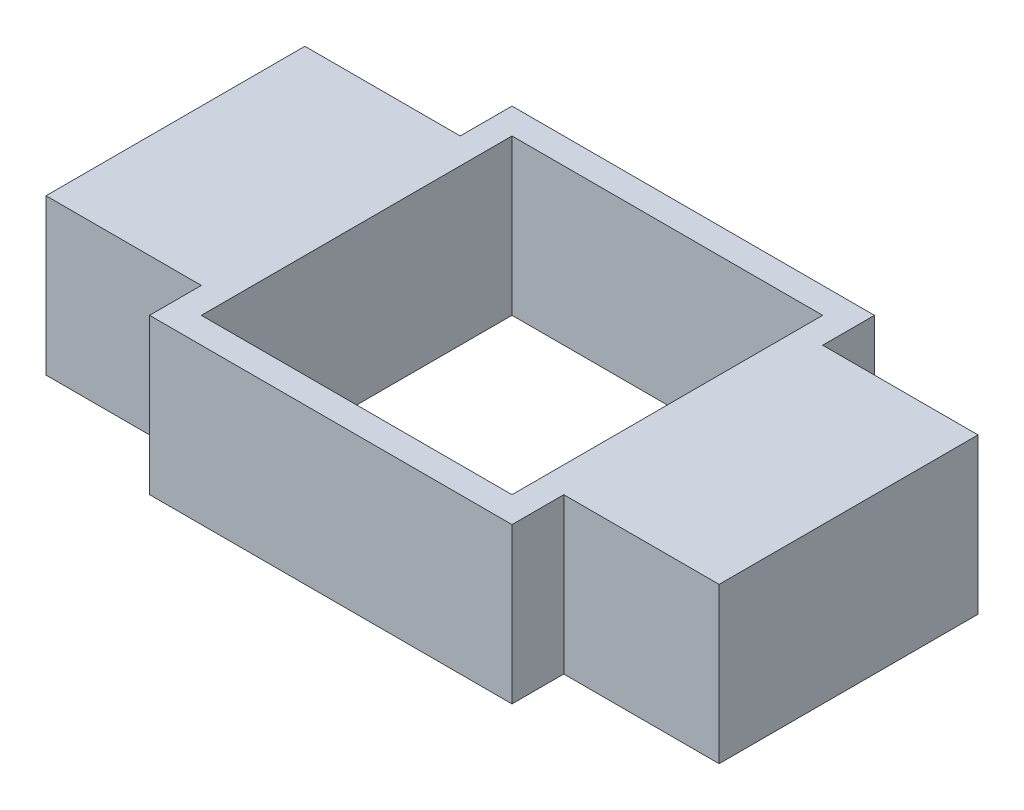
from build123d import *

# Parameters (mm, degrees)
SKETCH1_W           = 7
SKETCH1_H           = 7
BOSS_EXTRUDE1_DEPTH = 3
SKETCH4_W           = 3
SKETCH4_H           = 5
BOSS_EXTRUDE2_DEPTH = 3
SKETCH5_W           = 6
SKETCH5_H           = 6
CUT_EXTRUDE1_DEPTH  = 10


with BuildPart() as part:
    # Sketch1 → Boss-Extrude1 (new body)
    with BuildSketch(Plane(origin=(0, 0, 0), x_dir=(1, 0, 0), z_dir=(0, 1, 0))):
        Rectangle(SKETCH1_W, SKETCH1_H)
    extrude(amount=BOSS_EXTRUDE1_DEPTH)

    # Sketch4 → Boss-Extrude2 (add)
    with BuildSketch(Plane(origin=(0, 3, 0), x_dir=(1, 0, 0), z_dir=(0, 1, 0))):
        with Locations((-5, 0)):
            Rectangle(SKETCH4_W, SKETCH4_H)
        with Locations((5, 0)):
            Rectangle(SKETCH4_W, SKETCH4_H)
    extrude(amount=-BOSS_EXTRUDE2_DEPTH)

    # Sketch5 → Cut-Extrude1 (cut)
    with BuildSketch(Plane(origin=(0, 3, 0), x_dir=(1, 0, 0), z_dir=(0, 1, 0))):
        Rectangle(SKETCH5_W, SKETCH5_H)
    extrude(amount=-CUT_EXTRUDE1_DEPTH, mode=Mode.SUBTRACT)


solid = part.part
